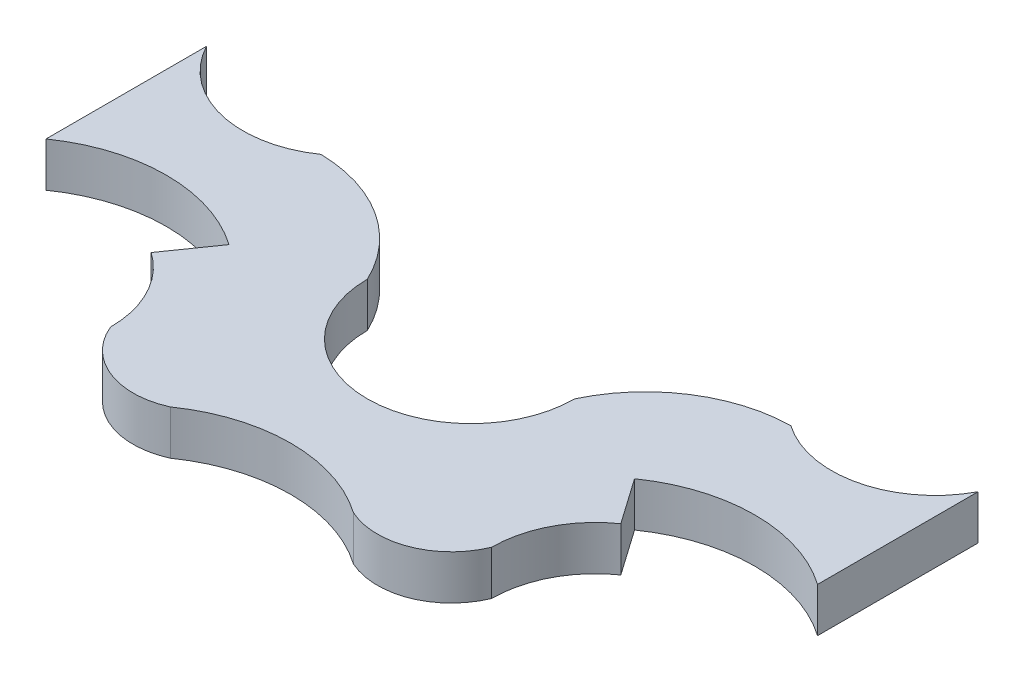
from build123d import *

# Parameters (mm, degrees)
BOSS_EXTRUDE1_DEPTH = 3


with BuildPart() as part:
    # Sketch3 → Boss-Extrude1 (new body)
    with BuildSketch(Plane(origin=(0, 0, 0), x_dir=(1, 0, 0), z_dir=(0, 1, 0))):
        with BuildLine():
            Line((-13.694996915, 20.301363277), (-15.860247962, 17.20906431))
            ThreePointArc((-15.860247962, 17.20906431), (-13.666207185, 14.707240293), (-12.875283017, 11.475))
            ThreePointArc((-12.875283017, 11.475), (-10.090653959, 8.727908609), (-6.180286102, 8.826363277))
            ThreePointArc((-6.180286102, 8.826363277), (0, 10.775), (6.180286102, 8.826363277))
            ThreePointArc((6.180286102, 8.826363277), (10.090653959, 8.727908609), (12.875283017, 11.475))
            ThreePointArc((12.875283017, 11.475), (13.666207185, 14.707240293), (15.860247962, 17.20906431))
            Line((15.860247962, 17.20906431), (13.694996915, 20.301363277))
            ThreePointArc((13.694996915, 20.301363277), (19.875283017, 22.25), (26.055569119, 20.301363277))
            Line((26.055569119, 20.301363277), (26.055569119, 31.138046441))
            ThreePointArc((26.055569119, 31.138046441), (21.514872246, 27.619726518), (15.870079226, 28.68406431))
            ThreePointArc((15.870079226, 28.68406431), (10.616247764, 27.083629141), (7, 22.95))
            ThreePointArc((7, 22.95), (0, 15.95), (-7, 22.95))
            ThreePointArc((-7, 22.95), (-10.616247764, 27.083629141), (-15.870079226, 28.68406431))
            ThreePointArc((-15.870079226, 28.68406431), (-21.514872246, 27.619726518), (-26.055569119, 31.138046441))
            Line((-26.055569119, 31.138046441), (-26.055569119, 20.301363277))
            ThreePointArc((-26.055569119, 20.301363277), (-19.875283017, 22.25), (-13.694996915, 20.301363277))
        make_face()
    extrude(amount=BOSS_EXTRUDE1_DEPTH)


solid = part.part
